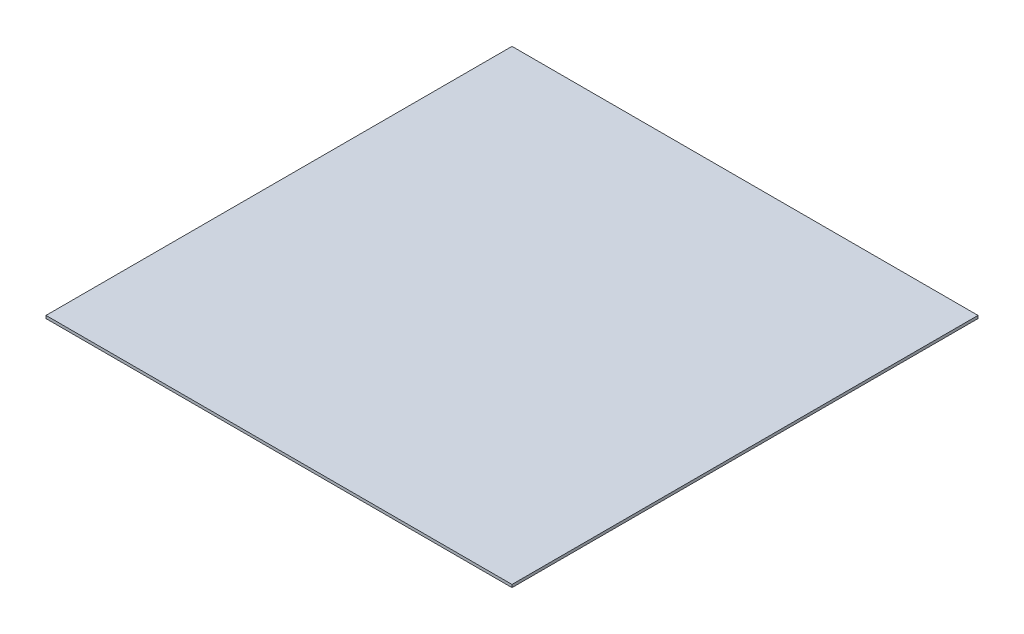
from build123d import *

# Parameters (mm, degrees)
SKETCH_1_W      = 500
SKETCH_1_H      = 500
EXTRUDE_1_DEPTH = 3


with BuildPart() as part:
    # Эскиз1 → Бобышка-Вытянуть1 (new body)
    with BuildSketch(Plane(origin=(0, 0, 0), x_dir=(1, 0, 0), z_dir=(0, 1, 0))):
        Rectangle(SKETCH_1_W, SKETCH_1_H)
    extrude(amount=EXTRUDE_1_DEPTH)


solid = part.part
